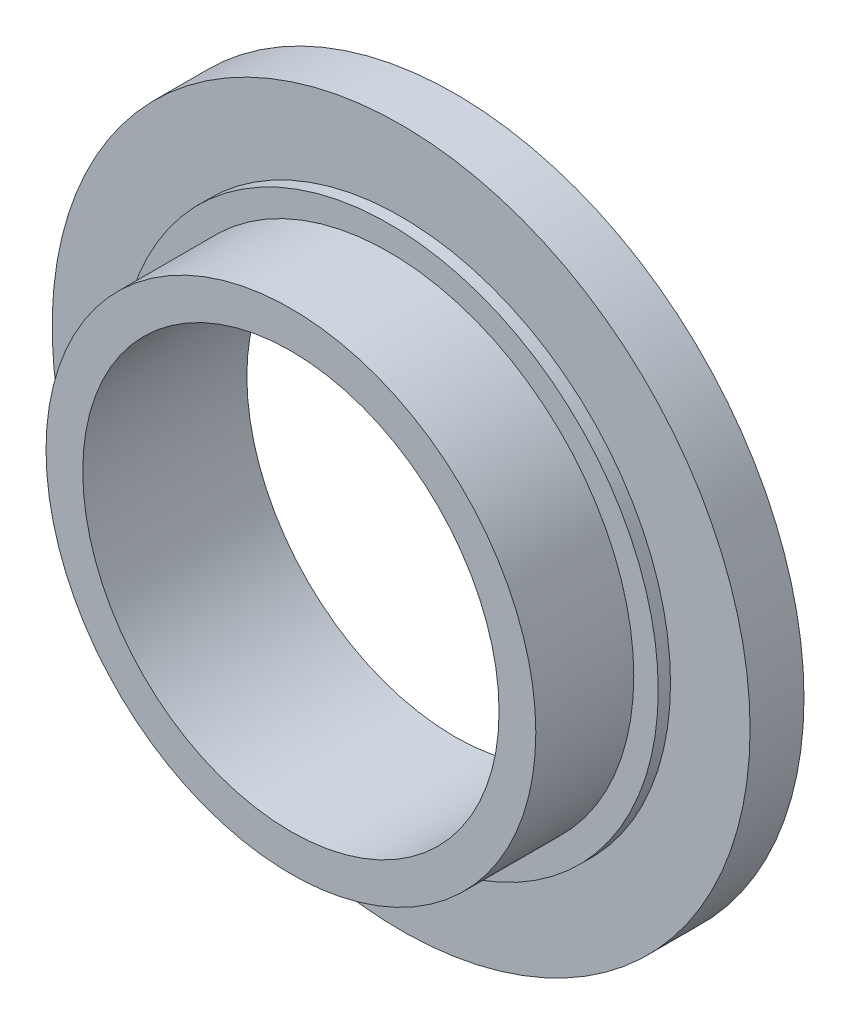
from build123d import *

# Parameters (mm, degrees)
SKETCH1_R          = 14.25
EXTRUDE1_DEPTH     = 2.2
SKETCH2_R          = 11
EXTRUDE2_DEPTH     = 0.5
SKETCH3_R          = 10
EXTRUDE3_DEPTH     = 4
SKETCH4_R          = 8.5
CUT_EXTRUDE1_DEPTH = 22.23711374


with BuildPart() as part:
    # Sketch1 → Extrude1 (new body)
    with BuildSketch(Plane.XY):
        Circle(SKETCH1_R)
    extrude(amount=EXTRUDE1_DEPTH)

    # Sketch2 → Extrude2 (add)
    with BuildSketch(Plane.XY.offset(2.2)):
        Circle(SKETCH2_R)
    extrude(amount=EXTRUDE2_DEPTH)

    # Sketch3 → Extrude3 (add)
    with BuildSketch(Plane.XY.offset(2.7)):
        Circle(SKETCH3_R)
    extrude(amount=EXTRUDE3_DEPTH)

    # Sketch4 → Cut-Extrude1 (cut, through all)
    with BuildSketch(Plane.XY.offset(6.7)):
        Circle(SKETCH4_R)
    extrude(amount=-CUT_EXTRUDE1_DEPTH, mode=Mode.SUBTRACT)


solid = part.part
